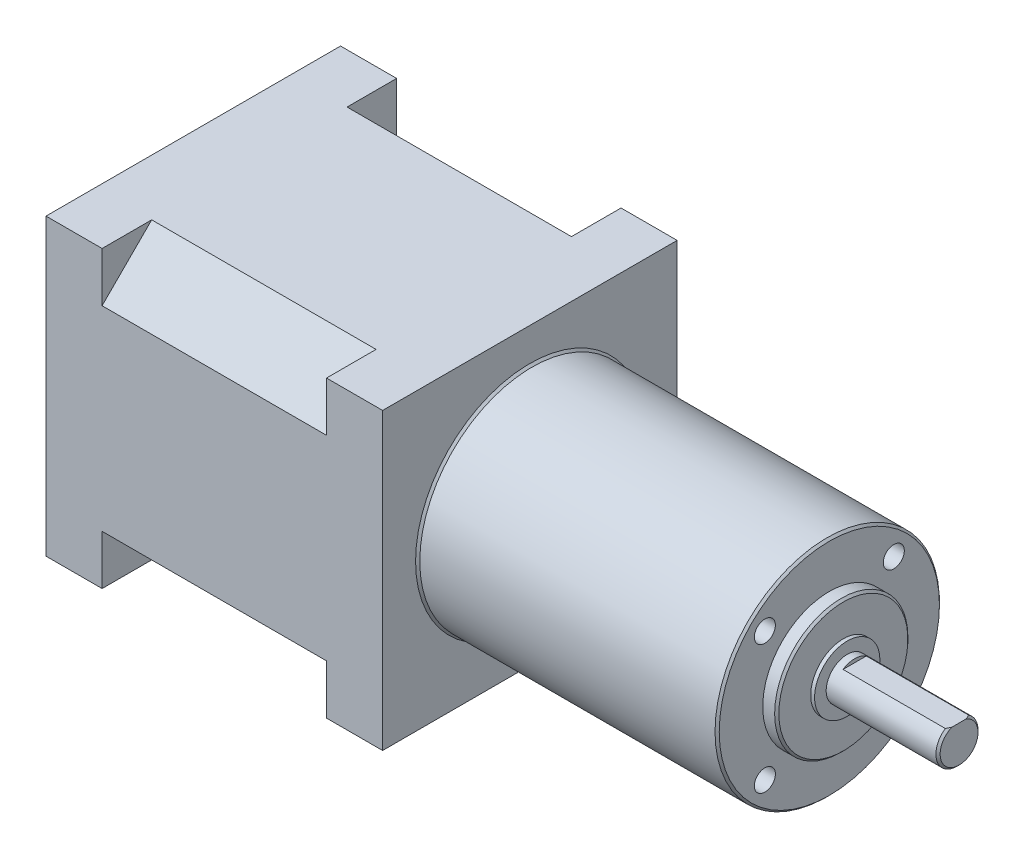
from build123d import *

# Parameters (mm, degrees)
SKETCH1_W           = 42
SKETCH1_H           = 42
BOSS_EXTRUDE1_DEPTH = 48
SKETCH2_R           = 16
BOSS_EXTRUDE2_DEPTH = 42.7
SKETCH7_W           = 16.587443852
SKETCH7_H           = 11.908554944
CUT_EXTRUDE1_DEPTH  = 2
CHAMFER1_SIZE       = 0.3
SKETCH8_R           = 1.5
CUT_EXTRUDE2_DEPTH  = 10
CUT_EXTRUDE3_DEPTH  = 32


with BuildPart() as part:
    # Sketch1 → Boss-Extrude1 (new body)
    with BuildSketch(Plane(origin=(0, 0, 0), x_dir=(0, 0, -1), z_dir=(1, 0, 0))):
        with Locations((21, 21)):
            Rectangle(SKETCH1_W, SKETCH1_H)
    extrude(amount=BOSS_EXTRUDE1_DEPTH)

    # Sketch2 → Boss-Extrude2 (add)
    with BuildSketch(Plane(origin=(48, 0, 0), x_dir=(0, 0, -1), z_dir=(1, 0, 0))):
        with Locations((21, 21)):
            Circle(SKETCH2_R)
    extrude(amount=BOSS_EXTRUDE2_DEPTH)

    # Sketch5 → Revolve1 (revolve)
    with BuildSketch(Plane(origin=(0, 0, -21), x_dir=(-1, 0, 0), z_dir=(0, 0, -1))):
        Polygon((-90.7, 30.5), (-92.7, 30.5), (-92.7, 25.65608714), (-93.252163767, 25.65608714), (-93.252163767, 24), (-109.2, 24), (-109.2, 21), (-90.7, 21), align=None)
    revolve(axis=Axis((109.2, 21, -21), (-1, 0, 0)))

    # Sketch7 → Cut-Extrude1 (cut)
    with BuildSketch(Plane(origin=(0, 23.5, 0), x_dir=(1, 0, 0), z_dir=(0, 1, 0))):
        with Locations((102.608605833, 20.527447563)):
            Rectangle(SKETCH7_W, SKETCH7_H)
    extrude(amount=CUT_EXTRUDE1_DEPTH, mode=Mode.SUBTRACT)

    # Chamfer1
    chamfer1_edges = [part.edges().sort_by_distance(p)[0] for p in [
        (48, 21, -5),
        (90.7, 21, -5),
        (92.7, 11.5, -21),
        (109.2, 18, -21),
    ]]
    chamfer(chamfer1_edges, length=CHAMFER1_SIZE)

    # Sketch8 → Cut-Extrude2 (cut)
    with BuildSketch(Plane(origin=(90.7, 0, 0), x_dir=(0, 0, -1), z_dir=(1, 0, 0))):
        with Locations((30.192388155, 30.192388155)):
            Circle(SKETCH8_R)
        with Locations((30.192388155, 11.807611845)):
            Circle(SKETCH8_R)
        with Locations((11.807611845, 30.192388155)):
            Circle(SKETCH8_R)
        with Locations((11.807611845, 11.807611845)):
            Circle(SKETCH8_R)
    extrude(amount=-CUT_EXTRUDE2_DEPTH, mode=Mode.SUBTRACT)

    # Sketch9 → Cut-Extrude3 (cut)
    with BuildSketch(Plane(origin=(40, 0, 0), x_dir=(0, 0, -1), z_dir=(1, 0, 0))):
        Polygon((34.928932188, 42), (42, 34.928932188), (42, 42), align=None)
        Polygon((42, 0), (42, 7.071067812), (34.928932188, 0), align=None)
        Polygon((0, 34.928932188), (7.071067812, 42), (0, 42), align=None)
        Polygon((0, 0), (7.071067812, 0), (0, 7.071067812), align=None)
    extrude(amount=-CUT_EXTRUDE3_DEPTH, mode=Mode.SUBTRACT)


solid = part.part
